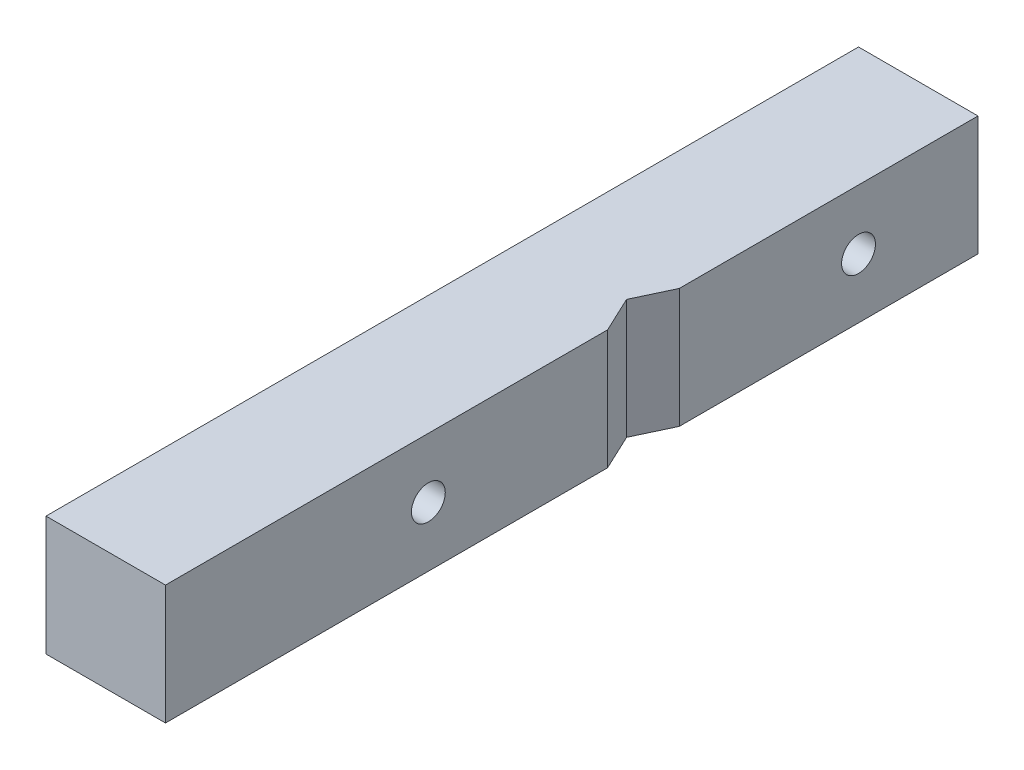
from build123d import *

# Parameters (mm, degrees)
SKETCH1_W               = 15.875
SKETCH1_H               = 15.875
BOSS_EXTRUDE1_DEPTH     = 53.975
CUT_EXTRUDE1_DEPTH      = 57.818308284
CUT_EXTRUDE1_DEPTH_BACK = 57.818308284
F_12_24_TAPPED_HOLE1_D  = 4.4958


with BuildPart() as part:
    # Sketch1 → Boss-Extrude1 (new, symmetric)
    with BuildSketch(Plane.XY):
        Rectangle(SKETCH1_W, SKETCH1_H)
    extrude(amount=BOSS_EXTRUDE1_DEPTH, both=True)

    # Sketch2 → Cut-Extrude1 (cut, two sides: drawn at the far end of the back side and taken through both)
    with BuildSketch(Plane(origin=(0, 7.9375, 0), x_dir=(1, 0, 0), z_dir=(0, 1, 0)).offset(-CUT_EXTRUDE1_DEPTH_BACK)):
        Polygon((71.794217754, 150.202262663), (7.9375, 14.2875), (5.699938661, 9.525), (7.9375, 4.7625), (71.794217754, -131.152262663), (372.130716448, -131.152262663), (372.130716448, 150.202262663), align=None)
    extrude(amount=CUT_EXTRUDE1_DEPTH + CUT_EXTRUDE1_DEPTH_BACK, mode=Mode.SUBTRACT)

    # #12-24 Tapped Hole1 (through all)
    with Locations(Plane(origin=(7.9375, 0, 0), x_dir=(0, 0, -1), z_dir=(1, 0, 0))):
        with Locations((38.1, 0), (-19.05, 0)):
            Hole(F_12_24_TAPPED_HOLE1_D / 2)


solid = part.part
